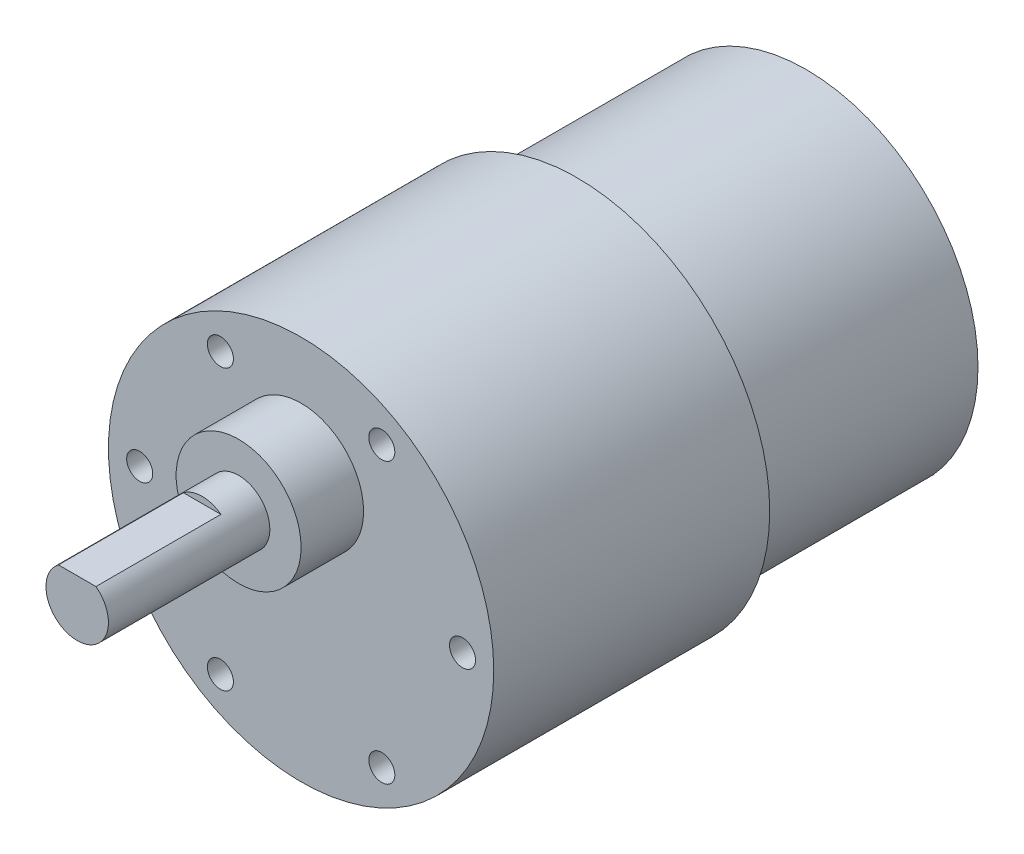
from build123d import *

# Parameters (mm, degrees)
SKETCH_1_R             = 18.5
EXTRUDE_1_DEPTH        = 26.5
SKETCH_2_R             = 6
EXTRUDE_2_DEPTH        = 6
SKETCH_3_R             = 3
EXTRUDE_3_DEPTH        = 15.5
SKETCH_4_W             = 6.445073496
SKETCH_4_H             = 1.792044826
CUT_EXTRUDE_1_DEPTH    = 12
SKETCH_5_R             = 16.5
EXTRUDE_4_DEPTH        = 22
HOLE_WIZARD_M3_1_D     = 2.5
HOLE_WIZARD_M3_1_DEPTH = 7.5
HOLE_WIZARD_M3_1_TIP   = 0.751075774
SKETCH_8_R             = 14
EXTRUDE_5_DEPTH        = 4.5
CUT_EXTRUDE_START      = -2.5
SKETCH_9_R             = 14
SKETCH_9_R_2           = 8
CUT_EXTRUDE_2_DEPTH    = 2.5
CUT_EXTRUDE_START_2    = -3
SKETCH_10_R            = 14
SKETCH_10_R_2          = 9.657403228
CUT_EXTRUDE_3_DEPTH    = 3


with BuildPart() as part:
    # 草图1 → 凸台-拉伸1 (new body)
    with BuildSketch(Plane.XY):
        Circle(SKETCH_1_R)
    extrude(amount=EXTRUDE_1_DEPTH)

    # 草图2 → 凸台-拉伸2 (add)
    with BuildSketch(Plane.XY.offset(26.5)):
        with Locations((0, 7)):
            Circle(SKETCH_2_R)
    extrude(amount=EXTRUDE_2_DEPTH)

    # 草图3 → 凸台-拉伸3 (add)
    with BuildSketch(Plane.XY.offset(32.5)):
        with Locations((0, 7)):
            Circle(SKETCH_3_R)
    extrude(amount=EXTRUDE_3_DEPTH)

    # 草图4 → 切除-拉伸1 (cut)
    with BuildSketch(Plane.XY.offset(48)):
        with Locations((0.299511506, 10.296022413)):
            Rectangle(SKETCH_4_W, SKETCH_4_H)
    extrude(amount=-CUT_EXTRUDE_1_DEPTH, mode=Mode.SUBTRACT)

    # 草图5 → 凸台-拉伸4 (add)
    with BuildSketch(Plane(origin=(0, 0, 0), x_dir=(-1, 0, 0), z_dir=(0, 0, -1))):
        with Locations(Location((0, 0, 0), (0, 0, 180))):
            Circle(SKETCH_5_R)
    extrude(amount=EXTRUDE_4_DEPTH)

    # M3 螺纹孔1
    with Locations(Plane(origin=(-7.75, 13.423393759, 26.5), x_dir=(1, 0, 0), z_dir=(0, 0, 1))):
        with Locations((0, 0), (15.5, 0), (23.25, -13.423393759), (15.5, -26.846787518), (0, -26.846787518), (-7.75, -13.423393759)):
            Hole(HOLE_WIZARD_M3_1_D / 2, depth=HOLE_WIZARD_M3_1_DEPTH)
            with Locations((0, 0, -(HOLE_WIZARD_M3_1_DEPTH + HOLE_WIZARD_M3_1_TIP / 2))):  # 118° drill point
                Cone(0, HOLE_WIZARD_M3_1_D / 2, HOLE_WIZARD_M3_1_TIP, mode=Mode.SUBTRACT)

    # 草图8 → 凸台-拉伸5 (add)
    with BuildSketch(Plane(origin=(0, 0, -22), x_dir=(-1, 0, 0), z_dir=(0, 0, -1))):
        Circle(SKETCH_8_R)
    extrude(amount=EXTRUDE_5_DEPTH)

    # 草图9 → 切除-拉伸2 (cut)
    with BuildSketch(Plane(origin=(0, 0, -24.5), x_dir=(-1, 0, 0), z_dir=(0, 0, -1)).offset(CUT_EXTRUDE_START)):
        Circle(SKETCH_9_R)
        Circle(SKETCH_9_R_2, mode=Mode.SUBTRACT)
    extrude(amount=CUT_EXTRUDE_2_DEPTH, mode=Mode.SUBTRACT)

    # 草图10 → 切除-拉伸3 (cut)
    with BuildSketch(Plane(origin=(0, 0, -26.5), x_dir=(-1, 0, 0), z_dir=(0, 0, -1)).offset(CUT_EXTRUDE_START_2)):
        Circle(SKETCH_10_R)
        Circle(SKETCH_10_R_2, mode=Mode.SUBTRACT)
    extrude(amount=CUT_EXTRUDE_3_DEPTH, mode=Mode.SUBTRACT)


solid = part.part
